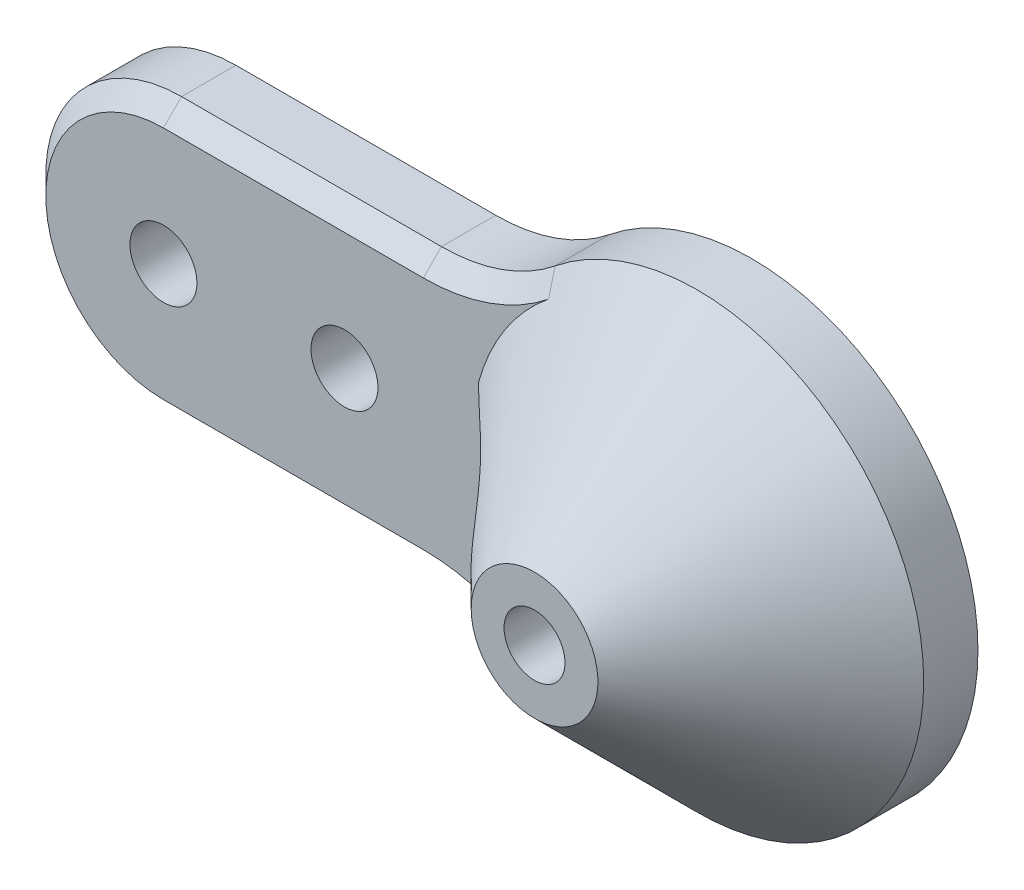
from build123d import *

# Parameters (mm, degrees)
SKETCH1_R           = 1.85
SKETCH1_R_2         = 5
BOSS_EXTRUDE1_DEPTH = 4
CHAMFER1_SIZE       = 1
CUT_EXTRUDE1_DEPTH  = 166.566482115
SKETCH5_2_R         = 1.85
CUT_EXTRUDE2_DEPTH  = 4


with BuildPart() as part:
    # Sketch1 → Boss-Extrude1 (new body)
    with BuildSketch(Plane.XY):
        with BuildLine():
            Line((123.9, 7.5), (138.257864376, 7.5))
            ThreePointArc((138.257864376, 7.5), (141.59119771, 8.071909584), (144.543257987, 9.722222222))
            ThreePointArc((144.543257987, 9.722222222), (164.9, 0), (144.543257987, -9.722222222))
            ThreePointArc((144.543257987, -9.722222222), (141.59119771, -8.071909584), (138.257864376, -7.5))
            Line((138.257864376, -7.5), (123.9, -7.5))
            ThreePointArc((123.9, -7.5), (116.4, 0), (123.9, 7.5))
        make_face()
        with Locations((160.9, 0)):
            Circle(SKETCH1_R, mode=Mode.SUBTRACT)
        with Locations((152.4, 0)):
            Circle(SKETCH1_R_2, mode=Mode.SUBTRACT)
        with Locations((143.9, 0)):
            Circle(SKETCH1_R, mode=Mode.SUBTRACT)
        with Locations((133.9, 0)):
            Circle(SKETCH1_R, mode=Mode.SUBTRACT)
        with Locations((123.9, 0)):
            Circle(SKETCH1_R, mode=Mode.SUBTRACT)
    extrude(amount=BOSS_EXTRUDE1_DEPTH)

    # Chamfer1
    chamfer1_edges = [part.edges().sort_by_distance(p)[0] for p in [
        (141.59119771, 8.071909584, 4),
        (131.078932188, 7.5, 4),
        (116.4, 0, 4),
        (131.078932188, -7.5, 4),
        (141.59119771, -8.071909584, 4),
        (164.9, 0, 4),
    ]]
    chamfer(chamfer1_edges, length=CHAMFER1_SIZE)

    # Sketch3 → Revolve2 (revolve)
    with BuildSketch(Plane(origin=(152.4, 0, 0), x_dir=(0, 0, -1), z_dir=(1, 0, 0)), mode=Mode.PRIVATE) as revolve2_sk:
        Polygon((-4, -11.5), (-4, -5), (-7.671572875, -5), (-9, -3.671572875), (-9, -1.683342633), (-12, -1.683342633), (-12, -3.5), align=None)
    revolve(revolve2_sk.sketch.rotate(Axis((152.4, 0, 0), (0, 0, 1)), 270), axis=Axis((152.4, 0, 0), (0, 0, 1)))

    # Sketch4 → Cut-Extrude1 (cut, through all)
    with BuildSketch(Plane(origin=(0, 0, 4), x_dir=(-1, 0, 0), z_dir=(0, 0, -1))):
        with BuildLine():
            Line((-143.9, -3), (-141.298198344, -3))
            ThreePointArc((-141.298198344, -3), (-140.9, 0), (-141.298198344, 3))
            Line((-141.298198344, 3), (-143.9, 3))
            ThreePointArc((-143.9, 3), (-146.9, 0), (-143.9, -3))
        make_face()
    extrude(amount=-CUT_EXTRUDE1_DEPTH, mode=Mode.SUBTRACT)

    # Sketch5<2> → Cut-Extrude2 (cut)
    with BuildSketch(Plane(origin=(0, 0, 0), x_dir=(-1, 0, 0), z_dir=(0, 0, -1))):
        with Locations((-152.4, -8.5)):
            Circle(SKETCH5_2_R)
        with Locations((-152.4, 8.5)):
            Circle(SKETCH5_2_R)
    extrude(amount=-CUT_EXTRUDE2_DEPTH, mode=Mode.SUBTRACT)


solid = part.part
